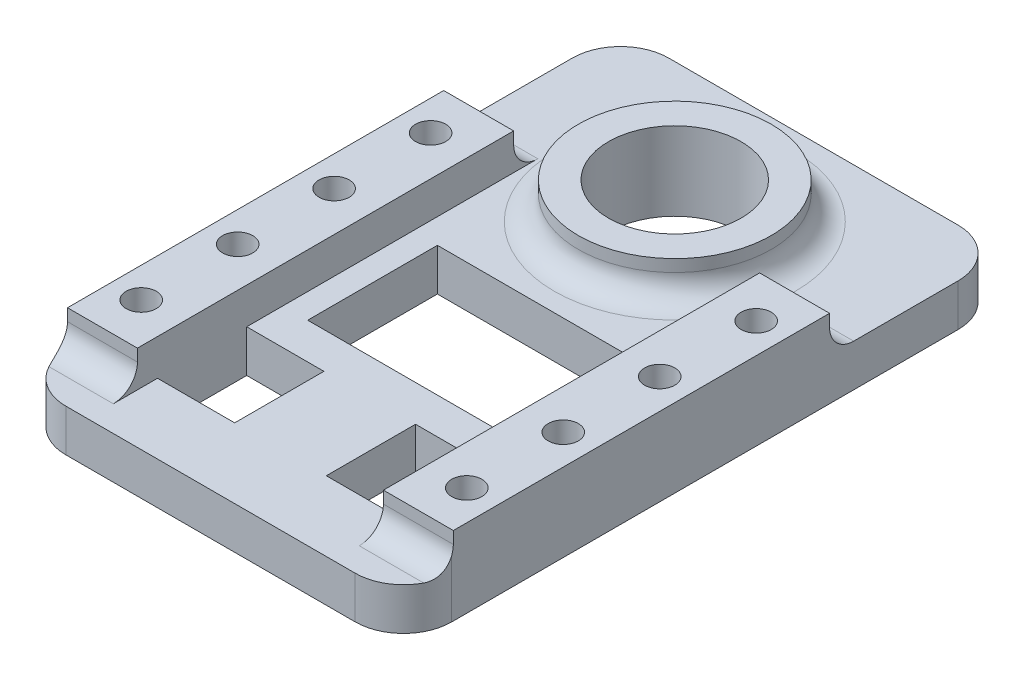
from build123d import *

# Parameters (mm, degrees)
SKETCH1_W                = 32
SKETCH1_H                = 50
SKETCH1_R                = 5.5
SKETCH1_R_2              = 1.25
BOSS_EXTRUDE1_DEPTH      = 3.5
FILETE1_R                = 4
ESBO_O1_R                = 8
ESBO_O1_R_2              = 5.5
ESBO_O1_W                = 5.8
ESBO_O1_H                = 31.201183342
RESSALTO_EXTRUS_O1_DEPTH = 3
ESBO_O3_W                = 16.288942458
ESBO_O3_H                = 10.757575704
CORTE_EXTRUS_O1_DEPTH    = 30.887288268
CORTE_EXTRUS_O2_REACH    = 32.385
ESBO_O4_R                = 1.25
FILETE2_R                = 2


with BuildPart() as part:
    # Sketch1 → Boss-Extrude1 (new body)
    with BuildSketch(Plane(origin=(0, 0, 0), x_dir=(1, 0, 0), z_dir=(0, 1, 0))):
        Rectangle(SKETCH1_W, SKETCH1_H)
        with Locations(Location((0, 13.5, 0), (0, 0, 270))):
            Circle(SKETCH1_R, mode=Mode.SUBTRACT)
        with Locations(Location((13.5, 6.75, 0), (0, 0, 270))):
            Circle(SKETCH1_R_2, mode=Mode.SUBTRACT)
        with Locations(Location((13.5, -1.25, 0), (0, 0, 270))):
            Circle(SKETCH1_R_2, mode=Mode.SUBTRACT)
        with Locations(Location((13.5, -9.25, 0), (0, 0, 270))):
            Circle(SKETCH1_R_2, mode=Mode.SUBTRACT)
        with Locations(Location((13.5, -17.25, 0), (0, 0, 270))):
            Circle(SKETCH1_R_2, mode=Mode.SUBTRACT)
        with Locations(Location((-13.5, -17.25, 0), (0, 0, 90))):
            Circle(SKETCH1_R_2, mode=Mode.SUBTRACT)
        with Locations(Location((-13.5, -9.25, 0), (0, 0, 90))):
            Circle(SKETCH1_R_2, mode=Mode.SUBTRACT)
        with Locations(Location((-13.5, -1.25, 0), (0, 0, 90))):
            Circle(SKETCH1_R_2, mode=Mode.SUBTRACT)
        with Locations(Location((-13.5, 6.75, 0), (0, 0, 90))):
            Circle(SKETCH1_R_2, mode=Mode.SUBTRACT)
        Polygon((3.8, -15.5), (3.8, -11.8), (10.2, -11.8), (10.2, -19.2), (3.8, -19.2), align=None, mode=Mode.SUBTRACT)
        Polygon((-10.2, -19.2), (-3.8, -19.2), (-3.8, -15.5), (-3.8, -11.8), (-10.2, -11.8), align=None, mode=Mode.SUBTRACT)
    extrude(amount=BOSS_EXTRUDE1_DEPTH)

    # Filete1
    filete1_edges = [part.edges().sort_by_distance(p)[0] for p in [
        (16, 1.75, 25),
        (-16, 1.75, 25),
        (-16, 1.75, -25),
        (16, 1.75, -25),
    ]]
    fillet(filete1_edges, radius=FILETE1_R)

    # Esboço1 → Ressalto-extrusão1 (add)
    # profile 1 of 3: a face of its own
    with BuildSketch(Plane(origin=(0, 3.5, 0), x_dir=(1, 0, 0), z_dir=(0, 1, 0))):
        with Locations(Location((0, 13.5, 0), (0, 0, 90))):
            Circle(ESBO_O1_R)
        with Locations(Location((0, 13.5, 0), (0, 0, 270))):
            Circle(ESBO_O1_R_2, mode=Mode.SUBTRACT)
    # profile 2 of 3: a face of its own
    with BuildSketch(Plane(origin=(0, 3.5, 0), x_dir=(1, 0, 0), z_dir=(0, 1, 0))):
        with Locations((-13.1, -5.264208671)):
            Rectangle(ESBO_O1_W, ESBO_O1_H)
    # profile 3 of 3: a face of its own
    with BuildSketch(Plane(origin=(0, 3.5, 0), x_dir=(1, 0, 0), z_dir=(0, 1, 0))):
        with Locations((13.1, -5.264208671)):
            Rectangle(ESBO_O1_W, ESBO_O1_H)
    extrude(amount=RESSALTO_EXTRUS_O1_DEPTH)

    # Esboço3 → Corte-extrusão1 (cut, through all)
    with BuildSketch(Plane(origin=(0, 3.5, 0), x_dir=(1, 0, 0), z_dir=(0, 1, 0))):
        with Locations((0, -3.421212148)):
            Rectangle(ESBO_O3_W, ESBO_O3_H)
    extrude(amount=-CORTE_EXTRUS_O1_DEPTH, mode=Mode.SUBTRACT)

    # Esboço4 → Corte-extrusão2 (cut, up to next)
    with BuildSketch(Plane.XZ, mode=Mode.PRIVATE) as corte_extrus_o2_sk1:
        with Locations(Location((-13.5, 17.25, 0), (0, 0, 270))):
            Circle(ESBO_O4_R)
    corte_extrus_o2_tool1 = extrude(corte_extrus_o2_sk1.sketch, amount=-CORTE_EXTRUS_O2_REACH, mode=Mode.PRIVATE) & part.part
    # Esboço4 → Corte-extrusão2 (cut, up to next)
    with BuildSketch(Plane.XZ, mode=Mode.PRIVATE) as corte_extrus_o2_sk2:
        with Locations(Location((-13.5, 9.25, 0), (0, 0, 270))):
            Circle(ESBO_O4_R)
    corte_extrus_o2_tool2 = extrude(corte_extrus_o2_sk2.sketch, amount=-CORTE_EXTRUS_O2_REACH, mode=Mode.PRIVATE) & part.part
    # Esboço4 → Corte-extrusão2 (cut, up to next)
    with BuildSketch(Plane.XZ, mode=Mode.PRIVATE) as corte_extrus_o2_sk3:
        with Locations(Location((-13.5, 1.25, 0), (0, 0, 270))):
            Circle(ESBO_O4_R)
    corte_extrus_o2_tool3 = extrude(corte_extrus_o2_sk3.sketch, amount=-CORTE_EXTRUS_O2_REACH, mode=Mode.PRIVATE) & part.part
    # Esboço4 → Corte-extrusão2 (cut, up to next)
    with BuildSketch(Plane.XZ, mode=Mode.PRIVATE) as corte_extrus_o2_sk4:
        with Locations(Location((-13.5, -6.75, 0), (0, 0, 270))):
            Circle(ESBO_O4_R)
    corte_extrus_o2_tool4 = extrude(corte_extrus_o2_sk4.sketch, amount=-CORTE_EXTRUS_O2_REACH, mode=Mode.PRIVATE) & part.part
    # Esboço4 → Corte-extrusão2 (cut, up to next)
    with BuildSketch(Plane.XZ, mode=Mode.PRIVATE) as corte_extrus_o2_sk5:
        with Locations(Location((13.5, 1.25, 0), (0, 0, 270))):
            Circle(ESBO_O4_R)
    corte_extrus_o2_tool5 = extrude(corte_extrus_o2_sk5.sketch, amount=-CORTE_EXTRUS_O2_REACH, mode=Mode.PRIVATE) & part.part
    # Esboço4 → Corte-extrusão2 (cut, up to next)
    with BuildSketch(Plane.XZ, mode=Mode.PRIVATE) as corte_extrus_o2_sk6:
        with Locations(Location((13.5, 9.25, 0), (0, 0, 270))):
            Circle(ESBO_O4_R)
    corte_extrus_o2_tool6 = extrude(corte_extrus_o2_sk6.sketch, amount=-CORTE_EXTRUS_O2_REACH, mode=Mode.PRIVATE) & part.part
    # Esboço4 → Corte-extrusão2 (cut, up to next)
    with BuildSketch(Plane.XZ, mode=Mode.PRIVATE) as corte_extrus_o2_sk7:
        with Locations(Location((13.5, 17.25, 0), (0, 0, 270))):
            Circle(ESBO_O4_R)
    corte_extrus_o2_tool7 = extrude(corte_extrus_o2_sk7.sketch, amount=-CORTE_EXTRUS_O2_REACH, mode=Mode.PRIVATE) & part.part
    # Esboço4 → Corte-extrusão2 (cut, up to next)
    with BuildSketch(Plane.XZ, mode=Mode.PRIVATE) as corte_extrus_o2_sk8:
        with Locations(Location((13.5, -6.75, 0), (0, 0, 270))):
            Circle(ESBO_O4_R)
    corte_extrus_o2_tool8 = extrude(corte_extrus_o2_sk8.sketch, amount=-CORTE_EXTRUS_O2_REACH, mode=Mode.PRIVATE) & part.part
    add(corte_extrus_o2_tool1.solids().sort_by_distance((-13.5, 0, 17.25))[0], mode=Mode.SUBTRACT)
    add(corte_extrus_o2_tool2.solids().sort_by_distance((-13.5, 0, 9.25))[0], mode=Mode.SUBTRACT)
    add(corte_extrus_o2_tool3.solids().sort_by_distance((-13.5, 0, 1.25))[0], mode=Mode.SUBTRACT)
    add(corte_extrus_o2_tool4.solids().sort_by_distance((-13.5, 0, -6.75))[0], mode=Mode.SUBTRACT)
    add(corte_extrus_o2_tool5.solids().sort_by_distance((13.5, 0, 1.25))[0], mode=Mode.SUBTRACT)
    add(corte_extrus_o2_tool6.solids().sort_by_distance((13.5, 0, 9.25))[0], mode=Mode.SUBTRACT)
    add(corte_extrus_o2_tool7.solids().sort_by_distance((13.5, 0, 17.25))[0], mode=Mode.SUBTRACT)
    add(corte_extrus_o2_tool8.solids().sort_by_distance((13.5, 0, -6.75))[0], mode=Mode.SUBTRACT)

    # Filete2
    filete2_edges = [part.edges().sort_by_distance(p)[0] for p in [
        (-13.1, 3.5, 20.864800342),
        (-13.1, 3.5, -10.336383),
        (13.1, 3.5, -10.336383),
        (13.1, 3.5, 20.864800342),
        (0, 3.5, -5.5),
    ]]
    fillet(filete2_edges, radius=FILETE2_R)


solid = part.part
